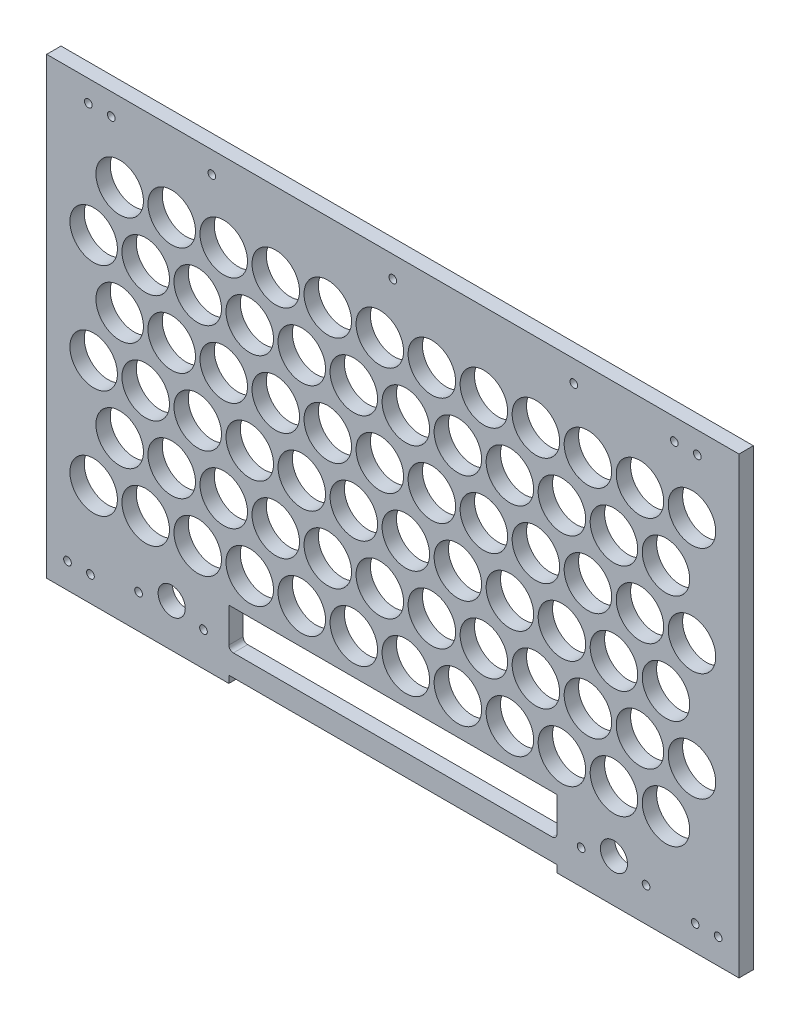
from build123d import *

# Parameters (mm, degrees)
SKETCH1_W                  = 306.05000007
SKETCH1_H                  = 197.4250001
BOSS_EXTRUDE1_DEPTH        = 6.35
SKETCH3_R                  = 10.4988
CUT_EXTRUDE1_DEPTH         = 187.132543615
SKETCH4_R                  = 10.4988
CUT_EXTRUDE2_DEPTH         = 187.132543615
LPATTERN1_COUNT            = 12
LPATTERN1_PITCH            = 23
LPATTERN2_COPY_1_SKETCH_R  = 10.4988
LPATTERN2_COPY_1_DEPTH     = 187.132543615
LPATTERN2_COPY_2_SKETCH_R  = 10.4988
LPATTERN2_COPY_2_DEPTH     = 187.132543615
LPATTERN2_COPY_3_SKETCH_R  = 10.4988
LPATTERN2_COPY_3_DEPTH     = 187.132543615
LPATTERN2_COPY_4_SKETCH_R  = 10.4988
LPATTERN2_COPY_4_DEPTH     = 187.132543615
LPATTERN2_COPY_5_SKETCH_R  = 10.4988
LPATTERN2_COPY_5_DEPTH     = 187.132543615
LPATTERN2_COPY_6_SKETCH_R  = 10.4988
LPATTERN2_COPY_6_DEPTH     = 187.132543615
LPATTERN2_COPY_7_SKETCH_R  = 10.4988
LPATTERN2_COPY_7_DEPTH     = 187.132543615
LPATTERN2_COPY_8_SKETCH_R  = 10.4988
LPATTERN2_COPY_8_DEPTH     = 187.132543615
LPATTERN2_COPY_9_SKETCH_R  = 10.4988
LPATTERN2_COPY_9_DEPTH     = 187.132543615
LPATTERN2_COPY_10_SKETCH_R = 10.4988
LPATTERN2_COPY_10_DEPTH    = 187.132543615
LPATTERN2_COPY_11_SKETCH_R = 10.4988
LPATTERN2_COPY_11_DEPTH    = 187.132543615
LPATTERN2_COPY_12_SKETCH_R = 10.4988
LPATTERN2_COPY_12_DEPTH    = 187.132543615
LPATTERN2_COPY_13_SKETCH_R = 10.4988
LPATTERN2_COPY_13_DEPTH    = 187.132543615
LPATTERN2_COPY_14_SKETCH_R = 10.4988
LPATTERN2_COPY_14_DEPTH    = 187.132543615
LPATTERN2_COPY_15_SKETCH_R = 10.4988
LPATTERN2_COPY_15_DEPTH    = 187.132543615
LPATTERN2_COPY_16_SKETCH_R = 10.4988
LPATTERN2_COPY_16_DEPTH    = 187.132543615
LPATTERN2_COPY_17_SKETCH_R = 10.4988
LPATTERN2_COPY_17_DEPTH    = 187.132543615
LPATTERN2_COPY_18_SKETCH_R = 10.4988
LPATTERN2_COPY_18_DEPTH    = 187.132543615
LPATTERN2_COPY_19_SKETCH_R = 10.4988
LPATTERN2_COPY_19_DEPTH    = 187.132543615
LPATTERN2_COPY_20_SKETCH_R = 10.4988
LPATTERN2_COPY_20_DEPTH    = 187.132543615
LPATTERN2_COPY_21_SKETCH_R = 10.4988
LPATTERN2_COPY_21_DEPTH    = 187.132543615
LPATTERN2_COPY_22_SKETCH_R = 10.4988
LPATTERN2_COPY_22_DEPTH    = 187.132543615
LPATTERN2_COPY_23_SKETCH_R = 10.4988
LPATTERN2_COPY_23_DEPTH    = 187.132543615
LPATTERN2_COPY_24_SKETCH_R = 10.4988
LPATTERN2_COPY_24_DEPTH    = 187.132543615
LPATTERN2_COPY_25_SKETCH_R = 10.4988
LPATTERN2_COPY_25_DEPTH    = 187.132543615
LPATTERN2_COPY_26_SKETCH_R = 10.4988
LPATTERN2_COPY_26_DEPTH    = 187.132543615
LPATTERN2_COPY_27_SKETCH_R = 10.4988
LPATTERN2_COPY_27_DEPTH    = 187.132543615
LPATTERN2_COPY_28_SKETCH_R = 10.4988
LPATTERN2_COPY_28_DEPTH    = 187.132543615
LPATTERN2_COPY_29_SKETCH_R = 10.4988
LPATTERN2_COPY_29_DEPTH    = 187.132543615
LPATTERN2_COPY_30_SKETCH_R = 10.4988
LPATTERN2_COPY_30_DEPTH    = 187.132543615
LPATTERN2_COPY_31_SKETCH_R = 10.4988
LPATTERN2_COPY_31_DEPTH    = 187.132543615
LPATTERN2_COPY_32_SKETCH_R = 10.4988
LPATTERN2_COPY_32_DEPTH    = 187.132543615
LPATTERN2_COPY_33_SKETCH_R = 10.4988
LPATTERN2_COPY_33_DEPTH    = 187.132543615
LPATTERN2_COPY_34_SKETCH_R = 10.4988
LPATTERN2_COPY_34_DEPTH    = 187.132543615
LPATTERN2_COPY_35_SKETCH_R = 10.4988
LPATTERN2_COPY_35_DEPTH    = 187.132543615
LPATTERN2_COPY_36_SKETCH_R = 10.4988
LPATTERN2_COPY_36_DEPTH    = 187.132543615
LPATTERN2_COPY_37_SKETCH_R = 10.4988
LPATTERN2_COPY_37_DEPTH    = 187.132543615
LPATTERN2_COPY_38_SKETCH_R = 10.4988
LPATTERN2_COPY_38_DEPTH    = 187.132543615
LPATTERN2_COPY_39_SKETCH_R = 10.4988
LPATTERN2_COPY_39_DEPTH    = 187.132543615
LPATTERN2_COPY_40_SKETCH_R = 10.4988
LPATTERN2_COPY_40_DEPTH    = 187.132543615
LPATTERN2_COPY_41_SKETCH_R = 10.4988
LPATTERN2_COPY_41_DEPTH    = 187.132543615
LPATTERN2_COPY_42_SKETCH_R = 10.4988
LPATTERN2_COPY_42_DEPTH    = 187.132543615
LPATTERN2_COPY_43_SKETCH_R = 10.4988
LPATTERN2_COPY_43_DEPTH    = 187.132543615
LPATTERN2_COPY_44_SKETCH_R = 10.4988
LPATTERN2_COPY_44_DEPTH    = 187.132543615
LPATTERN2_COPY_45_SKETCH_R = 10.4988
LPATTERN2_COPY_45_DEPTH    = 187.132543615
LPATTERN2_COPY_46_SKETCH_R = 10.4988
LPATTERN2_COPY_46_DEPTH    = 187.132543615
LPATTERN2_COPY_47_SKETCH_R = 10.4988
LPATTERN2_COPY_47_DEPTH    = 187.132543615
LPATTERN2_COPY_48_SKETCH_R = 10.4988
LPATTERN2_COPY_48_DEPTH    = 187.132543615
SKETCH13_W                 = 306.05000007
SKETCH13_H                 = 6.35
BOSS_EXTRUDE2_DEPTH        = 3.175
SKETCH14_R                 = 6
CUT_EXTRUDE3_DEPTH         = 187.132543615
M3_CLEARANCE_HOLE1_D       = 3.4
SKETCH18_W                 = 145
SKETCH18_H                 = 6.35
CUT_EXTRUDE5_DEPTH         = 30
SKETCH19_W                 = 145
SKETCH19_H                 = 9.525
BOSS_EXTRUDE3_DEPTH        = 6.35
FILLET2_R                  = 2


with BuildPart() as part:
    # Sketch1 → Boss-Extrude1 (new body)
    with BuildSketch(Plane.XY):
        with Locations((3.5e-08, -7.06250005)):
            Rectangle(SKETCH1_W, SKETCH1_H)
    extrude(amount=BOSS_EXTRUDE1_DEPTH)

    # Sketch3 → Cut-Extrude1 (cut, through all)
    with BuildSketch(Plane.XY.offset(6.35)):
        with Locations((-132.25, -60)):
            Circle(SKETCH3_R)
    cut_extrude1 = extrude(amount=-CUT_EXTRUDE1_DEPTH, mode=Mode.SUBTRACT)

    # Sketch4 → Cut-Extrude2 (cut, through all)
    with BuildSketch(Plane.XY.offset(6.35)):
        with Locations((-120.75, -36)):
            Circle(SKETCH4_R)
    cut_extrude2 = extrude(amount=-CUT_EXTRUDE2_DEPTH, mode=Mode.SUBTRACT)

    # LPattern1: Cut-Extrude1, Cut-Extrude2 ×12
    with Locations(*[(i * LPATTERN1_PITCH, 0, 0) for i in range(1, LPATTERN1_COUNT)]):
        add(cut_extrude1, mode=Mode.SUBTRACT)
        add(cut_extrude2, mode=Mode.SUBTRACT)

    # LPattern2 copy 1 sketch → LPattern2 copy 1 (cut, through all)
    with BuildSketch(Plane(origin=(23, 48, 6.35), x_dir=(1, 0, 0), z_dir=(0, 0, 1))):
        with Locations((-132.25, -60)):
            Circle(LPATTERN2_COPY_1_SKETCH_R)
    extrude(amount=-LPATTERN2_COPY_1_DEPTH, mode=Mode.SUBTRACT)

    # LPattern2 copy 2 sketch → LPattern2 copy 2 (cut, through all)
    with BuildSketch(Plane(origin=(23, 96, 6.35), x_dir=(1, 0, 0), z_dir=(0, 0, 1))):
        with Locations((-132.25, -60)):
            Circle(LPATTERN2_COPY_2_SKETCH_R)
    extrude(amount=-LPATTERN2_COPY_2_DEPTH, mode=Mode.SUBTRACT)

    # LPattern2 copy 3 sketch → LPattern2 copy 3 (cut, through all)
    with BuildSketch(Plane(origin=(46, 48, 6.35), x_dir=(1, 0, 0), z_dir=(0, 0, 1))):
        with Locations((-132.25, -60)):
            Circle(LPATTERN2_COPY_3_SKETCH_R)
    extrude(amount=-LPATTERN2_COPY_3_DEPTH, mode=Mode.SUBTRACT)

    # LPattern2 copy 4 sketch → LPattern2 copy 4 (cut, through all)
    with BuildSketch(Plane(origin=(46, 96, 6.35), x_dir=(1, 0, 0), z_dir=(0, 0, 1))):
        with Locations((-132.25, -60)):
            Circle(LPATTERN2_COPY_4_SKETCH_R)
    extrude(amount=-LPATTERN2_COPY_4_DEPTH, mode=Mode.SUBTRACT)

    # LPattern2 copy 5 sketch → LPattern2 copy 5 (cut, through all)
    with BuildSketch(Plane(origin=(69, 48, 6.35), x_dir=(1, 0, 0), z_dir=(0, 0, 1))):
        with Locations((-132.25, -60)):
            Circle(LPATTERN2_COPY_5_SKETCH_R)
    extrude(amount=-LPATTERN2_COPY_5_DEPTH, mode=Mode.SUBTRACT)

    # LPattern2 copy 6 sketch → LPattern2 copy 6 (cut, through all)
    with BuildSketch(Plane(origin=(69, 96, 6.35), x_dir=(1, 0, 0), z_dir=(0, 0, 1))):
        with Locations((-132.25, -60)):
            Circle(LPATTERN2_COPY_6_SKETCH_R)
    extrude(amount=-LPATTERN2_COPY_6_DEPTH, mode=Mode.SUBTRACT)

    # LPattern2 copy 7 sketch → LPattern2 copy 7 (cut, through all)
    with BuildSketch(Plane(origin=(92, 48, 6.35), x_dir=(1, 0, 0), z_dir=(0, 0, 1))):
        with Locations((-132.25, -60)):
            Circle(LPATTERN2_COPY_7_SKETCH_R)
    extrude(amount=-LPATTERN2_COPY_7_DEPTH, mode=Mode.SUBTRACT)

    # LPattern2 copy 8 sketch → LPattern2 copy 8 (cut, through all)
    with BuildSketch(Plane(origin=(92, 96, 6.35), x_dir=(1, 0, 0), z_dir=(0, 0, 1))):
        with Locations((-132.25, -60)):
            Circle(LPATTERN2_COPY_8_SKETCH_R)
    extrude(amount=-LPATTERN2_COPY_8_DEPTH, mode=Mode.SUBTRACT)

    # LPattern2 copy 9 sketch → LPattern2 copy 9 (cut, through all)
    with BuildSketch(Plane(origin=(115, 48, 6.35), x_dir=(1, 0, 0), z_dir=(0, 0, 1))):
        with Locations((-132.25, -60)):
            Circle(LPATTERN2_COPY_9_SKETCH_R)
    extrude(amount=-LPATTERN2_COPY_9_DEPTH, mode=Mode.SUBTRACT)

    # LPattern2 copy 10 sketch → LPattern2 copy 10 (cut, through all)
    with BuildSketch(Plane(origin=(115, 96, 6.35), x_dir=(1, 0, 0), z_dir=(0, 0, 1))):
        with Locations((-132.25, -60)):
            Circle(LPATTERN2_COPY_10_SKETCH_R)
    extrude(amount=-LPATTERN2_COPY_10_DEPTH, mode=Mode.SUBTRACT)

    # LPattern2 copy 11 sketch → LPattern2 copy 11 (cut, through all)
    with BuildSketch(Plane(origin=(138, 48, 6.35), x_dir=(1, 0, 0), z_dir=(0, 0, 1))):
        with Locations((-132.25, -60)):
            Circle(LPATTERN2_COPY_11_SKETCH_R)
    extrude(amount=-LPATTERN2_COPY_11_DEPTH, mode=Mode.SUBTRACT)

    # LPattern2 copy 12 sketch → LPattern2 copy 12 (cut, through all)
    with BuildSketch(Plane(origin=(138, 96, 6.35), x_dir=(1, 0, 0), z_dir=(0, 0, 1))):
        with Locations((-132.25, -60)):
            Circle(LPATTERN2_COPY_12_SKETCH_R)
    extrude(amount=-LPATTERN2_COPY_12_DEPTH, mode=Mode.SUBTRACT)

    # LPattern2 copy 13 sketch → LPattern2 copy 13 (cut, through all)
    with BuildSketch(Plane(origin=(161, 48, 6.35), x_dir=(1, 0, 0), z_dir=(0, 0, 1))):
        with Locations((-132.25, -60)):
            Circle(LPATTERN2_COPY_13_SKETCH_R)
    extrude(amount=-LPATTERN2_COPY_13_DEPTH, mode=Mode.SUBTRACT)

    # LPattern2 copy 14 sketch → LPattern2 copy 14 (cut, through all)
    with BuildSketch(Plane(origin=(161, 96, 6.35), x_dir=(1, 0, 0), z_dir=(0, 0, 1))):
        with Locations((-132.25, -60)):
            Circle(LPATTERN2_COPY_14_SKETCH_R)
    extrude(amount=-LPATTERN2_COPY_14_DEPTH, mode=Mode.SUBTRACT)

    # LPattern2 copy 15 sketch → LPattern2 copy 15 (cut, through all)
    with BuildSketch(Plane(origin=(184, 48, 6.35), x_dir=(1, 0, 0), z_dir=(0, 0, 1))):
        with Locations((-132.25, -60)):
            Circle(LPATTERN2_COPY_15_SKETCH_R)
    extrude(amount=-LPATTERN2_COPY_15_DEPTH, mode=Mode.SUBTRACT)

    # LPattern2 copy 16 sketch → LPattern2 copy 16 (cut, through all)
    with BuildSketch(Plane(origin=(184, 96, 6.35), x_dir=(1, 0, 0), z_dir=(0, 0, 1))):
        with Locations((-132.25, -60)):
            Circle(LPATTERN2_COPY_16_SKETCH_R)
    extrude(amount=-LPATTERN2_COPY_16_DEPTH, mode=Mode.SUBTRACT)

    # LPattern2 copy 17 sketch → LPattern2 copy 17 (cut, through all)
    with BuildSketch(Plane(origin=(207, 48, 6.35), x_dir=(1, 0, 0), z_dir=(0, 0, 1))):
        with Locations((-132.25, -60)):
            Circle(LPATTERN2_COPY_17_SKETCH_R)
    extrude(amount=-LPATTERN2_COPY_17_DEPTH, mode=Mode.SUBTRACT)

    # LPattern2 copy 18 sketch → LPattern2 copy 18 (cut, through all)
    with BuildSketch(Plane(origin=(207, 96, 6.35), x_dir=(1, 0, 0), z_dir=(0, 0, 1))):
        with Locations((-132.25, -60)):
            Circle(LPATTERN2_COPY_18_SKETCH_R)
    extrude(amount=-LPATTERN2_COPY_18_DEPTH, mode=Mode.SUBTRACT)

    # LPattern2 copy 19 sketch → LPattern2 copy 19 (cut, through all)
    with BuildSketch(Plane(origin=(230, 48, 6.35), x_dir=(1, 0, 0), z_dir=(0, 0, 1))):
        with Locations((-132.25, -60)):
            Circle(LPATTERN2_COPY_19_SKETCH_R)
    extrude(amount=-LPATTERN2_COPY_19_DEPTH, mode=Mode.SUBTRACT)

    # LPattern2 copy 20 sketch → LPattern2 copy 20 (cut, through all)
    with BuildSketch(Plane(origin=(230, 96, 6.35), x_dir=(1, 0, 0), z_dir=(0, 0, 1))):
        with Locations((-132.25, -60)):
            Circle(LPATTERN2_COPY_20_SKETCH_R)
    extrude(amount=-LPATTERN2_COPY_20_DEPTH, mode=Mode.SUBTRACT)

    # LPattern2 copy 21 sketch → LPattern2 copy 21 (cut, through all)
    with BuildSketch(Plane(origin=(253, 48, 6.35), x_dir=(1, 0, 0), z_dir=(0, 0, 1))):
        with Locations((-132.25, -60)):
            Circle(LPATTERN2_COPY_21_SKETCH_R)
    extrude(amount=-LPATTERN2_COPY_21_DEPTH, mode=Mode.SUBTRACT)

    # LPattern2 copy 22 sketch → LPattern2 copy 22 (cut, through all)
    with BuildSketch(Plane(origin=(253, 96, 6.35), x_dir=(1, 0, 0), z_dir=(0, 0, 1))):
        with Locations((-132.25, -60)):
            Circle(LPATTERN2_COPY_22_SKETCH_R)
    extrude(amount=-LPATTERN2_COPY_22_DEPTH, mode=Mode.SUBTRACT)

    # LPattern2 copy 23 sketch → LPattern2 copy 23 (cut, through all)
    with BuildSketch(Plane(origin=(23, 48, 6.35), x_dir=(1, 0, 0), z_dir=(0, 0, 1))):
        with Locations((-120.75, -36)):
            Circle(LPATTERN2_COPY_23_SKETCH_R)
    extrude(amount=-LPATTERN2_COPY_23_DEPTH, mode=Mode.SUBTRACT)

    # LPattern2 copy 24 sketch → LPattern2 copy 24 (cut, through all)
    with BuildSketch(Plane(origin=(23, 96, 6.35), x_dir=(1, 0, 0), z_dir=(0, 0, 1))):
        with Locations((-120.75, -36)):
            Circle(LPATTERN2_COPY_24_SKETCH_R)
    extrude(amount=-LPATTERN2_COPY_24_DEPTH, mode=Mode.SUBTRACT)

    # LPattern2 copy 25 sketch → LPattern2 copy 25 (cut, through all)
    with BuildSketch(Plane(origin=(46, 48, 6.35), x_dir=(1, 0, 0), z_dir=(0, 0, 1))):
        with Locations((-120.75, -36)):
            Circle(LPATTERN2_COPY_25_SKETCH_R)
    extrude(amount=-LPATTERN2_COPY_25_DEPTH, mode=Mode.SUBTRACT)

    # LPattern2 copy 26 sketch → LPattern2 copy 26 (cut, through all)
    with BuildSketch(Plane(origin=(46, 96, 6.35), x_dir=(1, 0, 0), z_dir=(0, 0, 1))):
        with Locations((-120.75, -36)):
            Circle(LPATTERN2_COPY_26_SKETCH_R)
    extrude(amount=-LPATTERN2_COPY_26_DEPTH, mode=Mode.SUBTRACT)

    # LPattern2 copy 27 sketch → LPattern2 copy 27 (cut, through all)
    with BuildSketch(Plane(origin=(69, 48, 6.35), x_dir=(1, 0, 0), z_dir=(0, 0, 1))):
        with Locations((-120.75, -36)):
            Circle(LPATTERN2_COPY_27_SKETCH_R)
    extrude(amount=-LPATTERN2_COPY_27_DEPTH, mode=Mode.SUBTRACT)

    # LPattern2 copy 28 sketch → LPattern2 copy 28 (cut, through all)
    with BuildSketch(Plane(origin=(69, 96, 6.35), x_dir=(1, 0, 0), z_dir=(0, 0, 1))):
        with Locations((-120.75, -36)):
            Circle(LPATTERN2_COPY_28_SKETCH_R)
    extrude(amount=-LPATTERN2_COPY_28_DEPTH, mode=Mode.SUBTRACT)

    # LPattern2 copy 29 sketch → LPattern2 copy 29 (cut, through all)
    with BuildSketch(Plane(origin=(92, 48, 6.35), x_dir=(1, 0, 0), z_dir=(0, 0, 1))):
        with Locations((-120.75, -36)):
            Circle(LPATTERN2_COPY_29_SKETCH_R)
    extrude(amount=-LPATTERN2_COPY_29_DEPTH, mode=Mode.SUBTRACT)

    # LPattern2 copy 30 sketch → LPattern2 copy 30 (cut, through all)
    with BuildSketch(Plane(origin=(92, 96, 6.35), x_dir=(1, 0, 0), z_dir=(0, 0, 1))):
        with Locations((-120.75, -36)):
            Circle(LPATTERN2_COPY_30_SKETCH_R)
    extrude(amount=-LPATTERN2_COPY_30_DEPTH, mode=Mode.SUBTRACT)

    # LPattern2 copy 31 sketch → LPattern2 copy 31 (cut, through all)
    with BuildSketch(Plane(origin=(115, 48, 6.35), x_dir=(1, 0, 0), z_dir=(0, 0, 1))):
        with Locations((-120.75, -36)):
            Circle(LPATTERN2_COPY_31_SKETCH_R)
    extrude(amount=-LPATTERN2_COPY_31_DEPTH, mode=Mode.SUBTRACT)

    # LPattern2 copy 32 sketch → LPattern2 copy 32 (cut, through all)
    with BuildSketch(Plane(origin=(115, 96, 6.35), x_dir=(1, 0, 0), z_dir=(0, 0, 1))):
        with Locations((-120.75, -36)):
            Circle(LPATTERN2_COPY_32_SKETCH_R)
    extrude(amount=-LPATTERN2_COPY_32_DEPTH, mode=Mode.SUBTRACT)

    # LPattern2 copy 33 sketch → LPattern2 copy 33 (cut, through all)
    with BuildSketch(Plane(origin=(138, 48, 6.35), x_dir=(1, 0, 0), z_dir=(0, 0, 1))):
        with Locations((-120.75, -36)):
            Circle(LPATTERN2_COPY_33_SKETCH_R)
    extrude(amount=-LPATTERN2_COPY_33_DEPTH, mode=Mode.SUBTRACT)

    # LPattern2 copy 34 sketch → LPattern2 copy 34 (cut, through all)
    with BuildSketch(Plane(origin=(138, 96, 6.35), x_dir=(1, 0, 0), z_dir=(0, 0, 1))):
        with Locations((-120.75, -36)):
            Circle(LPATTERN2_COPY_34_SKETCH_R)
    extrude(amount=-LPATTERN2_COPY_34_DEPTH, mode=Mode.SUBTRACT)

    # LPattern2 copy 35 sketch → LPattern2 copy 35 (cut, through all)
    with BuildSketch(Plane(origin=(161, 48, 6.35), x_dir=(1, 0, 0), z_dir=(0, 0, 1))):
        with Locations((-120.75, -36)):
            Circle(LPATTERN2_COPY_35_SKETCH_R)
    extrude(amount=-LPATTERN2_COPY_35_DEPTH, mode=Mode.SUBTRACT)

    # LPattern2 copy 36 sketch → LPattern2 copy 36 (cut, through all)
    with BuildSketch(Plane(origin=(161, 96, 6.35), x_dir=(1, 0, 0), z_dir=(0, 0, 1))):
        with Locations((-120.75, -36)):
            Circle(LPATTERN2_COPY_36_SKETCH_R)
    extrude(amount=-LPATTERN2_COPY_36_DEPTH, mode=Mode.SUBTRACT)

    # LPattern2 copy 37 sketch → LPattern2 copy 37 (cut, through all)
    with BuildSketch(Plane(origin=(184, 48, 6.35), x_dir=(1, 0, 0), z_dir=(0, 0, 1))):
        with Locations((-120.75, -36)):
            Circle(LPATTERN2_COPY_37_SKETCH_R)
    extrude(amount=-LPATTERN2_COPY_37_DEPTH, mode=Mode.SUBTRACT)

    # LPattern2 copy 38 sketch → LPattern2 copy 38 (cut, through all)
    with BuildSketch(Plane(origin=(184, 96, 6.35), x_dir=(1, 0, 0), z_dir=(0, 0, 1))):
        with Locations((-120.75, -36)):
            Circle(LPATTERN2_COPY_38_SKETCH_R)
    extrude(amount=-LPATTERN2_COPY_38_DEPTH, mode=Mode.SUBTRACT)

    # LPattern2 copy 39 sketch → LPattern2 copy 39 (cut, through all)
    with BuildSketch(Plane(origin=(207, 48, 6.35), x_dir=(1, 0, 0), z_dir=(0, 0, 1))):
        with Locations((-120.75, -36)):
            Circle(LPATTERN2_COPY_39_SKETCH_R)
    extrude(amount=-LPATTERN2_COPY_39_DEPTH, mode=Mode.SUBTRACT)

    # LPattern2 copy 40 sketch → LPattern2 copy 40 (cut, through all)
    with BuildSketch(Plane(origin=(207, 96, 6.35), x_dir=(1, 0, 0), z_dir=(0, 0, 1))):
        with Locations((-120.75, -36)):
            Circle(LPATTERN2_COPY_40_SKETCH_R)
    extrude(amount=-LPATTERN2_COPY_40_DEPTH, mode=Mode.SUBTRACT)

    # LPattern2 copy 41 sketch → LPattern2 copy 41 (cut, through all)
    with BuildSketch(Plane(origin=(230, 48, 6.35), x_dir=(1, 0, 0), z_dir=(0, 0, 1))):
        with Locations((-120.75, -36)):
            Circle(LPATTERN2_COPY_41_SKETCH_R)
    extrude(amount=-LPATTERN2_COPY_41_DEPTH, mode=Mode.SUBTRACT)

    # LPattern2 copy 42 sketch → LPattern2 copy 42 (cut, through all)
    with BuildSketch(Plane(origin=(230, 96, 6.35), x_dir=(1, 0, 0), z_dir=(0, 0, 1))):
        with Locations((-120.75, -36)):
            Circle(LPATTERN2_COPY_42_SKETCH_R)
    extrude(amount=-LPATTERN2_COPY_42_DEPTH, mode=Mode.SUBTRACT)

    # LPattern2 copy 43 sketch → LPattern2 copy 43 (cut, through all)
    with BuildSketch(Plane(origin=(253, 48, 6.35), x_dir=(1, 0, 0), z_dir=(0, 0, 1))):
        with Locations((-120.75, -36)):
            Circle(LPATTERN2_COPY_43_SKETCH_R)
    extrude(amount=-LPATTERN2_COPY_43_DEPTH, mode=Mode.SUBTRACT)

    # LPattern2 copy 44 sketch → LPattern2 copy 44 (cut, through all)
    with BuildSketch(Plane(origin=(253, 96, 6.35), x_dir=(1, 0, 0), z_dir=(0, 0, 1))):
        with Locations((-120.75, -36)):
            Circle(LPATTERN2_COPY_44_SKETCH_R)
    extrude(amount=-LPATTERN2_COPY_44_DEPTH, mode=Mode.SUBTRACT)

    # LPattern2 copy 45 sketch → LPattern2 copy 45 (cut, through all)
    with BuildSketch(Plane(origin=(0, 48, 6.35), x_dir=(1, 0, 0), z_dir=(0, 0, 1))):
        with Locations((-132.25, -60)):
            Circle(LPATTERN2_COPY_45_SKETCH_R)
    extrude(amount=-LPATTERN2_COPY_45_DEPTH, mode=Mode.SUBTRACT)

    # LPattern2 copy 46 sketch → LPattern2 copy 46 (cut, through all)
    with BuildSketch(Plane(origin=(0, 96, 6.35), x_dir=(1, 0, 0), z_dir=(0, 0, 1))):
        with Locations((-132.25, -60)):
            Circle(LPATTERN2_COPY_46_SKETCH_R)
    extrude(amount=-LPATTERN2_COPY_46_DEPTH, mode=Mode.SUBTRACT)

    # LPattern2 copy 47 sketch → LPattern2 copy 47 (cut, through all)
    with BuildSketch(Plane(origin=(0, 48, 6.35), x_dir=(1, 0, 0), z_dir=(0, 0, 1))):
        with Locations((-120.75, -36)):
            Circle(LPATTERN2_COPY_47_SKETCH_R)
    extrude(amount=-LPATTERN2_COPY_47_DEPTH, mode=Mode.SUBTRACT)

    # LPattern2 copy 48 sketch → LPattern2 copy 48 (cut, through all)
    with BuildSketch(Plane(origin=(0, 96, 6.35), x_dir=(1, 0, 0), z_dir=(0, 0, 1))):
        with Locations((-120.75, -36)):
            Circle(LPATTERN2_COPY_48_SKETCH_R)
    extrude(amount=-LPATTERN2_COPY_48_DEPTH, mode=Mode.SUBTRACT)

    # Sketch13 → Boss-Extrude2 (add)
    with BuildSketch(Plane(origin=(0, 91.65, 0), x_dir=(1, 0, 0), z_dir=(0, 1, 0))):
        with Locations((3.5e-08, -3.175)):
            Rectangle(SKETCH13_W, SKETCH13_H)
    extrude(amount=BOSS_EXTRUDE2_DEPTH)

    # Sketch14 → Cut-Extrude3 (cut, through all)
    with BuildSketch(Plane(origin=(0, 0, 0), x_dir=(-1, 0, 0), z_dir=(0, 0, -1))):
        with Locations((-97.75, -86.7750001)):
            Circle(SKETCH14_R)
    cut_extrude3 = extrude(amount=-CUT_EXTRUDE3_DEPTH, mode=Mode.SUBTRACT)

    # Mirror1: Cut-Extrude3 across plane
    add(cut_extrude3.mirror(Plane(origin=(0, 0, 0), x_dir=(0, 0, 1), z_dir=(1, 0, 0))), mode=Mode.SUBTRACT)

    # M3 Clearance Hole1 (through all)
    with Locations(Plane(origin=(0, 0, 0), x_dir=(-1, 0, 0), z_dir=(0, 0, -1))):
        with Locations((-111.94, -90.775), (-83.25, -90.775), (83.712, -90.775), (80, 85.3), (0, 85.3), (-80, 85.3), (112.402, -90.775), (-143.817500066, -94.6000001), (-133.657500066, -94.6000001), (-134.610000066, 85.3), (-124.450000066, 85.3), (124.450000066, 85.3), (134.610000066, 85.3), (133.657500066, -94.6000001), (143.817500066, -94.6000001)):
            Hole(M3_CLEARANCE_HOLE1_D / 2)

    # Sketch18 → Cut-Extrude5 (cut)
    with BuildSketch(Plane.XZ.offset(105.7750001)):
        with Locations((0, 3.175)):
            Rectangle(SKETCH18_W, SKETCH18_H)
    extrude(amount=-CUT_EXTRUDE5_DEPTH, mode=Mode.SUBTRACT)

    # Sketch19 → Boss-Extrude3 (add)
    with BuildSketch(Plane(origin=(0, 0, 0), x_dir=(-1, 0, 0), z_dir=(0, 0, -1))):
        with Locations((0, -97.8375001)):
            Rectangle(SKETCH19_W, SKETCH19_H)
    extrude(amount=-BOSS_EXTRUDE3_DEPTH)

    # Fillet2
    fillet2_edges = [part.edges().sort_by_distance(p)[0] for p in [
        (72.5, -93.0750001, 3.175),
        (-72.5, -93.0750001, 3.175),
    ]]
    fillet(fillet2_edges, radius=FILLET2_R)


solid = part.part
